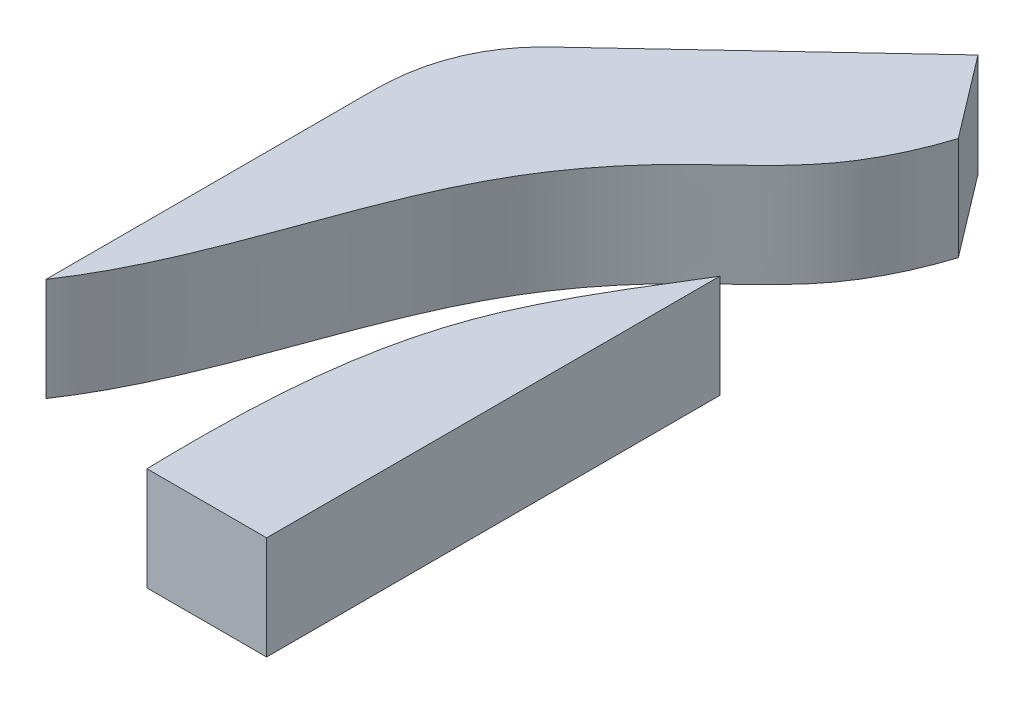
from build123d import *

# Parameters (mm, degrees)
BOSS_EXTRUDE1_DEPTH   = 10
BOSS_EXTRUDE1_2_DEPTH = 10


with BuildPart() as part:
    # Sketch1 → Boss-Extrude1 (new body)
    with BuildSketch(Plane(origin=(0, 0, 0), x_dir=(1, 0, 0), z_dir=(0, 1, 0))):
        with BuildLine():
            Line((5.433476937, -16.148700246), (5.433476937, -40.48083774))
            Line((5.433476937, -40.48083774), (5.433476937, -60.038229021))
            Line((5.433476937, -60.038229021), (-6.1594063, -60.038229021))
            add(Edge.make_bspline(
                [(5.433476937, -16.148700246), (2.448089637, -21.031180775), (-6.099224191, -34.262909027), (-6.363193197, -50.657943667), (-6.1594063, -60.038229021)],
                knots=[0, 0, 0, 0, 0.373828803, 1, 1, 1, 1], degree=3))
        make_face()
    extrude(amount=BOSS_EXTRUDE1_DEPTH)


with BuildPart() as body_2:
    # Sketch1 → Boss-Extrude1 2 (new body)
    with BuildSketch(Plane(origin=(0, 0, 0), x_dir=(1, 0, 0), z_dir=(0, 1, 0))):
        with BuildLine():
            Line((5.433476937, 6.95456054), (-0.618053814, 14.915651895))
            Line((-0.618053814, 14.915651895), (-21.609622, -4.759713708))
            add(Edge.make_bspline(
                [(-21.609622, -4.759713708), (-26.835982818, -9.42662947), (-26.934428436, -17.04557435)],
                knots=[0, 0, 0, 1, 1, 1], degree=2))
            Line((-26.934428436, -17.04557435), (-26.934428436, -49.040359802))
            add(Edge.make_bspline(
                [(5.433476937, 6.95456054), (4.504660032, 4.056786226), (1.623432731, -2.173396893), (-6.320224408, -8.592135406), (-18.078432993, -23.409919855), (-20.338944488, -39.267059515), (-26.934428436, -49.040359802)],
                knots=[0, 0, 0, 0, 0.140998177, 0.305677036, 0.462618672, 1, 1, 1, 1], degree=3))
        make_face()
    extrude(amount=BOSS_EXTRUDE1_2_DEPTH)


solid = Compound([part.part, body_2.part])
